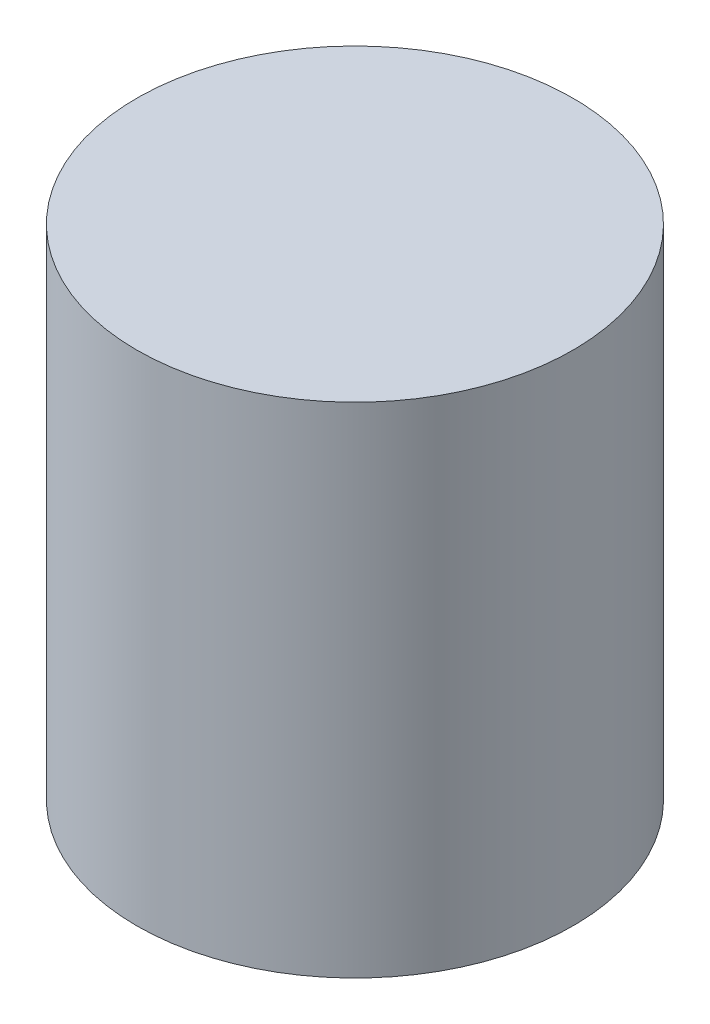
from build123d import *

# Parameters (mm, degrees)
SKETCH_1_R          = 17.5
EXTRUDE_1_DEPTH     = 40
SKETCH_2_R          = 12
CUT_EXTRUDE_1_DEPTH = 20


with BuildPart() as part:
    # 草图1 → 凸台-拉伸1 (new body)
    with BuildSketch(Plane(origin=(0, 0, 0), x_dir=(1, 0, 0), z_dir=(0, 1, 0))):
        with Locations(Location((0, 0, 0), (0, 0, 270))):
            Circle(SKETCH_1_R)
    extrude(amount=EXTRUDE_1_DEPTH)

    # 草图2 → 切除-拉伸1 (cut)
    with BuildSketch(Plane.XZ):
        with Locations(Location((0, 0, 0), (0, 0, 270))):
            Circle(SKETCH_2_R)
    extrude(amount=-CUT_EXTRUDE_1_DEPTH, mode=Mode.SUBTRACT)


solid = part.part
